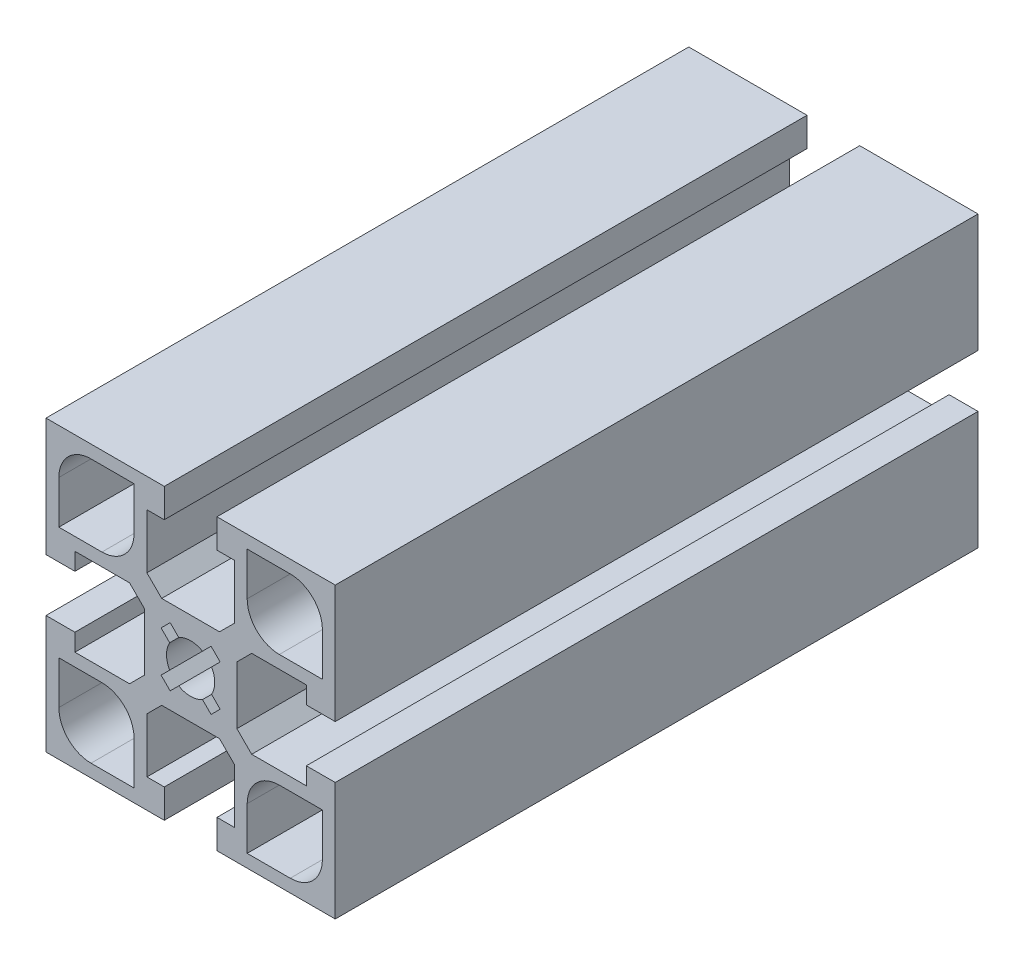
from build123d import *

# Parameters (mm, degrees)
BOSS_EXTRUDE1_DEPTH = 100


with BuildPart() as part:
    # Sketch1 → Boss-Extrude1 (new body)
    with BuildSketch(Plane.XY):
        Polygon((-17.999999991, -6.799999991), (-17.999999991, -4.099999991), (-22.499999991, -4.099999991), (-22.499999991, -22.499999991), (-4.099999991, -22.499999991), (-4.099999991, -17.999999991), (-6.799999991, -17.999999991), (-6.799999991, -9.499999991), (-4.499999991, -7.199999991), (4.500000009, -7.199999991), (6.800000009, -9.499999991), (6.800000009, -17.999999991), (4.100000009, -17.999999991), (4.100000009, -22.499999991), (22.500000009, -22.499999991), (22.500000009, -4.099999991), (18.000000009, -4.099999991), (18.000000009, -6.799999991), (9.500000009, -6.799999991), (7.200000009, -4.499999991), (7.200000009, 4.500000009), (9.500000009, 6.800000009), (18.000000009, 6.800000009), (18.000000009, 4.100000009), (22.500000009, 4.100000009), (22.500000009, 22.500000009), (4.100000009, 22.500000009), (4.100000009, 18.000000009), (6.800000009, 18.000000009), (6.800000009, 9.500000009), (4.500000009, 7.200000009), (-4.499999991, 7.200000009), (-6.799999991, 9.500000009), (-6.799999991, 18.000000009), (-4.099999991, 18.000000009), (-4.099999991, 22.500000009), (-22.499999991, 22.500000009), (-22.499999991, 4.100000009), (-17.999999991, 4.100000009), (-17.999999991, 6.800000009), (-9.499999991, 6.800000009), (-7.199999991, 4.500000009), (-7.199999991, -4.499999991), (-9.499999991, -6.799999991), align=None)
        with BuildLine():
            Line((-20.499999973, 8.799995438), (-20.499999973, 15.500000009))
            ThreePointArc((-20.499999973, 15.500000009), (-19.035533879, 19.035533915), (-15.499999973, 20.500000009))
            Line((-15.499999973, 20.500000009), (-8.799995402, 20.500000009))
            Line((-8.799995402, 20.500000009), (-8.799995402, 13.799995438))
            ThreePointArc((-8.799995402, 13.799995438), (-10.264461496, 10.264461532), (-13.799995402, 8.799995438))
            Line((-13.799995402, 8.799995438), (-20.499999973, 8.799995438))
        make_face(mode=Mode.SUBTRACT)
        with BuildLine():
            Line((20.500000009, 8.79999542), (13.799995438, 8.79999542))
            ThreePointArc((13.799995438, 8.79999542), (10.264461532, 10.264461514), (8.799995438, 13.79999542))
            Line((8.799995438, 13.79999542), (8.799995438, 20.499999991))
            Line((8.799995438, 20.499999991), (15.500000009, 20.499999991))
            ThreePointArc((15.500000009, 20.499999991), (19.035533915, 19.035533897), (20.500000009, 15.499999991))
            Line((20.500000009, 15.499999991), (20.500000009, 8.79999542))
        make_face(mode=Mode.SUBTRACT)
        with BuildLine():
            Line((15.499999991, -20.499999991), (8.79999542, -20.499999991))
            Line((8.79999542, -20.499999991), (8.79999542, -13.79999542))
            ThreePointArc((8.79999542, -13.79999542), (10.264461514, -10.264461514), (13.79999542, -8.79999542))
            Line((13.79999542, -8.79999542), (20.499999991, -8.79999542))
            Line((20.499999991, -8.79999542), (20.499999991, -15.499999991))
            ThreePointArc((20.499999991, -15.499999991), (19.035533897, -19.035533897), (15.499999991, -20.499999991))
        make_face(mode=Mode.SUBTRACT)
        with BuildLine():
            Line((-8.79999542, -20.499999973), (-15.499999991, -20.499999973))
            ThreePointArc((-15.499999991, -20.499999973), (-19.035533897, -19.035533879), (-20.499999991, -15.499999973))
            Line((-20.499999991, -15.499999973), (-20.499999991, -8.799995402))
            Line((-20.499999991, -8.799995402), (-13.79999542, -8.799995402))
            ThreePointArc((-13.79999542, -8.799995402), (-10.264461514, -10.264461496), (-8.79999542, -13.799995402))
            Line((-8.79999542, -13.799995402), (-8.79999542, -20.499999973))
        make_face(mode=Mode.SUBTRACT)
        with BuildLine():
            Line((-3.262737816, 1.848524254), (-4.596194076, 3.181980514))
            Line((-4.596194076, 3.181980514), (-3.181980513, 4.596194076))
            Line((-3.181980513, 4.596194076), (-1.848524253, 3.262737816))
            ThreePointArc((-1.848524253, 3.262737816), (2e-09, 3.749999997), (1.848524257, 3.262737816))
            Line((1.848524257, 3.262737816), (3.181980517, 4.596194076))
            Line((3.181980517, 4.596194076), (4.59619408, 3.181980513))
            Line((4.59619408, 3.181980513), (3.26273782, 1.848524253))
            ThreePointArc((3.26273782, 1.848524253), (3.75, -2e-09), (3.262737819, -1.848524257))
            Line((3.262737819, -1.848524257), (4.596194079, -3.181980517))
            Line((4.596194079, -3.181980517), (3.181980517, -4.596194079))
            Line((3.181980517, -4.596194079), (1.848524257, -3.262737819))
            ThreePointArc((1.848524257, -3.262737819), (2e-09, -3.75), (-1.848524253, -3.262737819))
            Line((-1.848524253, -3.262737819), (-3.181980515, -4.596194081))
            Line((-3.181980515, -4.596194081), (-4.596194078, -3.181980518))
            Line((-4.596194078, -3.181980518), (-3.262737816, -1.848524257))
            ThreePointArc((-3.262737816, -1.848524257), (-3.749999997, -2e-09), (-3.262737816, 1.848524254))
        make_face(mode=Mode.SUBTRACT)
    extrude(amount=BOSS_EXTRUDE1_DEPTH)


solid = part.part
